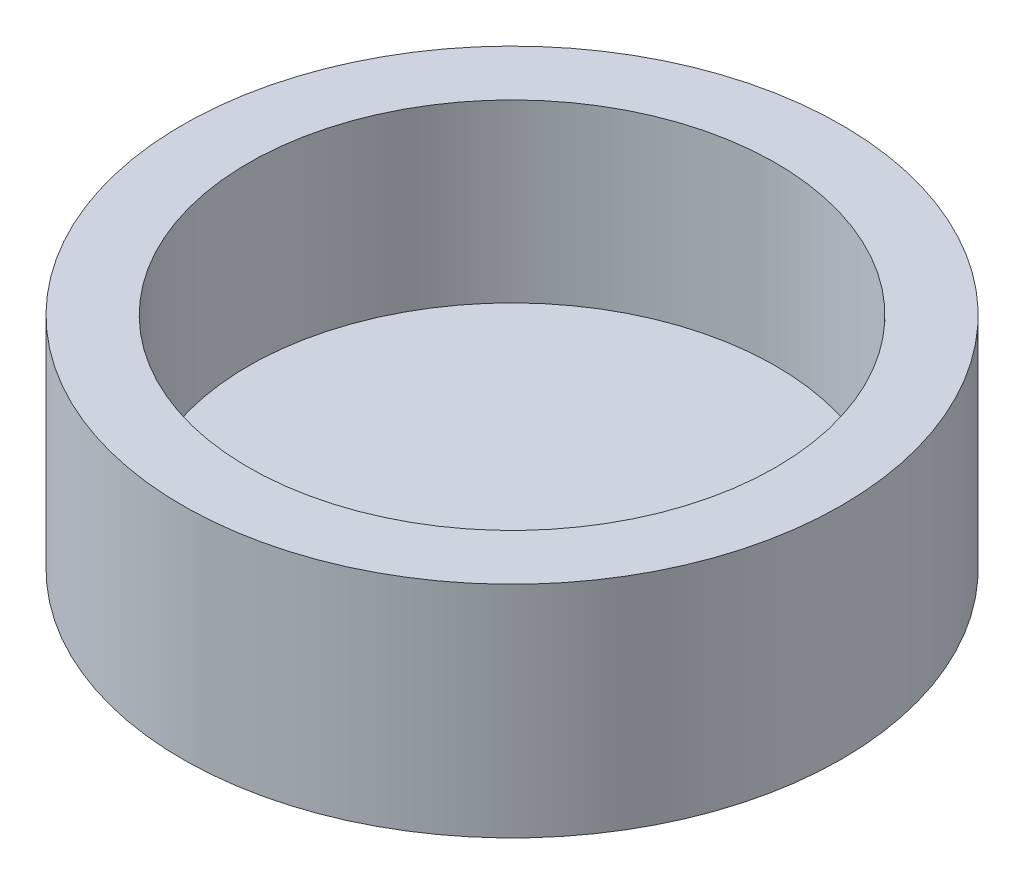
from build123d import *


with BuildPart() as part:
    # Sketch1 → Revolve1 (revolve)
    with BuildSketch(Plane.XY):
        Polygon((0, 0), (6, 0), (6, 4), (7.5, 4), (7.5, -1), (0, -1), align=None)
    revolve(axis=Axis((0, -99.703616051, 0), (0, 1, 0)))


solid = part.part
